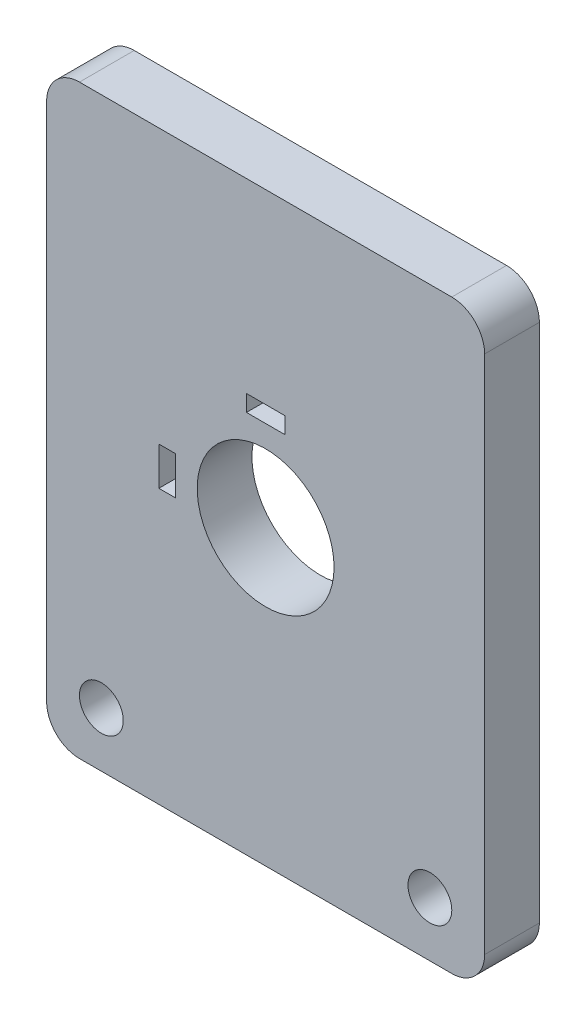
from build123d import *

# Parameters (mm, degrees)
SKETCH_1_W      = 40
SKETCH_1_H      = 53.5
SKETCH_1_R      = 6.25
SKETCH_1_R_2    = 2
SKETCH_1_W_2    = 3.5
SKETCH_1_H_2    = 1.5
SKETCH_1_W_3    = 1.5
SKETCH_1_H_3    = 3.5
EXTRUDE_1_DEPTH = 5
FILLET_1_R      = 3


with BuildPart() as part:
    # ｽｹｯﾁ1 → ﾎﾞｽ - 押し出し1 (new body)
    with BuildSketch(Plane.XY):
        with Locations((20, 26.75)):
            Rectangle(SKETCH_1_W, SKETCH_1_H)
        with Locations((20, 26.75)):
            Circle(SKETCH_1_R, mode=Mode.SUBTRACT)
        with Locations((35, 5)):
            Circle(SKETCH_1_R_2, mode=Mode.SUBTRACT)
        with Locations(Location((5, 5, 0), (0, 0, 180))):
            Circle(SKETCH_1_R_2, mode=Mode.SUBTRACT)
        with Locations((20, 35.75)):
            Rectangle(SKETCH_1_W_2, SKETCH_1_H_2, mode=Mode.SUBTRACT)
        with Locations((11, 26.75)):
            Rectangle(SKETCH_1_W_3, SKETCH_1_H_3, mode=Mode.SUBTRACT)
    extrude(amount=EXTRUDE_1_DEPTH)

    # ﾌｨﾚｯﾄ1
    fillet_1_edges = [part.edges().sort_by_distance(p)[0] for p in [
        (0, 53.5, 2.5),
        (40, 53.5, 2.5),
        (40, 0, 2.5),
        (0, 0, 2.5),
    ]]
    fillet(fillet_1_edges, radius=FILLET_1_R)


solid = part.part
